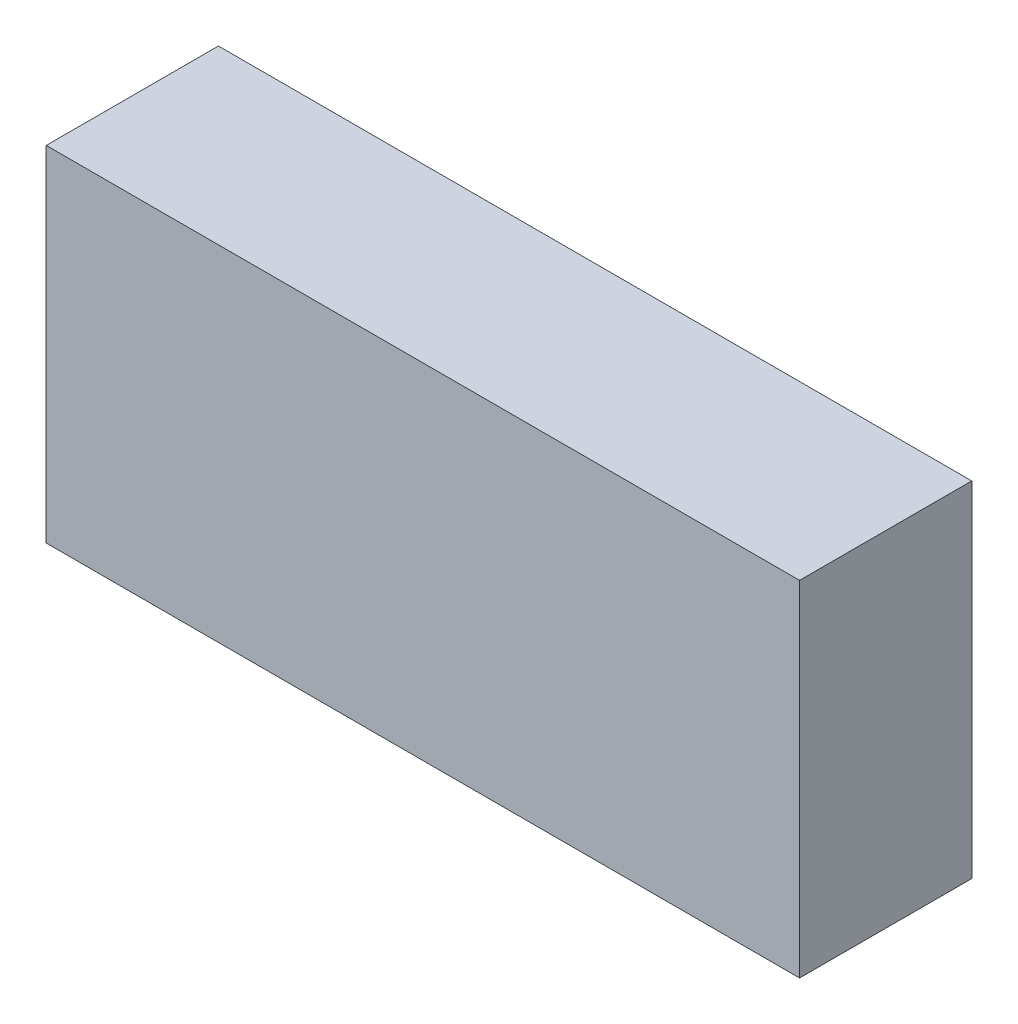
from build123d import *

# Parameters (mm, degrees)
CROQUIS1_W              = 35
CROQUIS1_H              = 8
SALIENTE_EXTRUIR1_DEPTH = 16


with BuildPart() as part:
    # Croquis1 → Saliente-Extruir1 (new body)
    with BuildSketch(Plane(origin=(0, 0, 0), x_dir=(1, 0, 0), z_dir=(0, 1, 0))):
        Rectangle(CROQUIS1_W, CROQUIS1_H)
    extrude(amount=SALIENTE_EXTRUIR1_DEPTH)


solid = part.part
